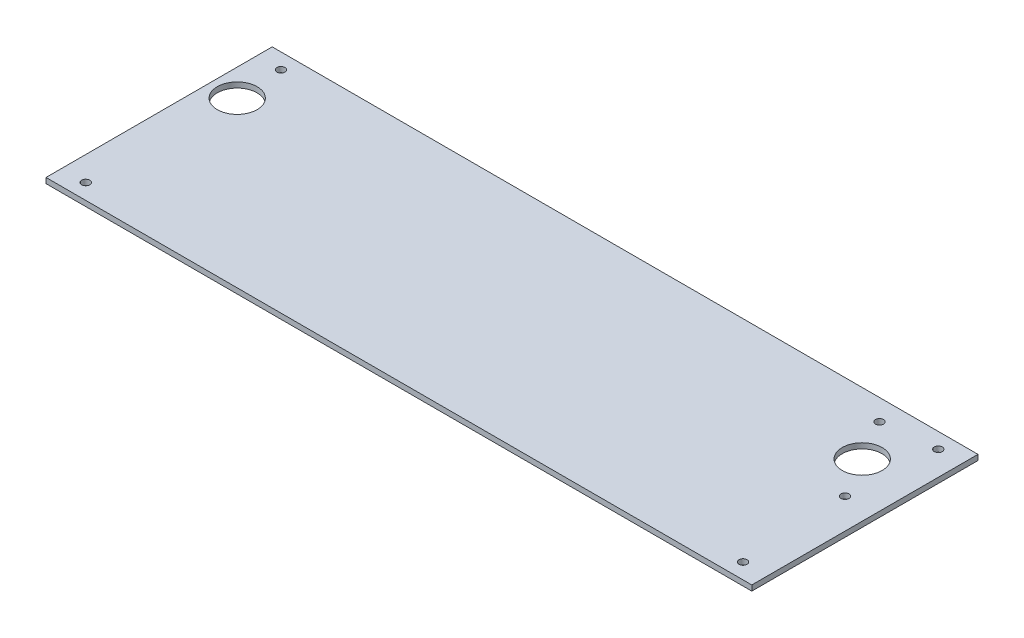
from build123d import *

# Parameters (mm, degrees)
SKETCH_1_W         = 262.1
SKETCH_1_H         = 84
EXTRUDE_1_DEPTH    = 1
SKETCH1_R          = 1.5
CUT_EXTRUDE1_DEPTH = 10
SKETCH4_R          = 7.4
CUT_EXTRUDE3_DEPTH = 138.630310978
SKETCH5_R          = 1.5
CUT_EXTRUDE4_DEPTH = 10


with BuildPart() as part:
    # 草图1 → 凸台-拉伸1 (new, symmetric)
    with BuildSketch(Plane(origin=(0, 0, 0), x_dir=(1, 0, 0), z_dir=(0, 1, 0))):
        Rectangle(SKETCH_1_W, SKETCH_1_H)
    extrude(amount=EXTRUDE_1_DEPTH, both=True)

    # Sketch1 → Cut-Extrude1 (cut)
    with BuildSketch(Plane(origin=(0, 1, 0), x_dir=(1, 0, 0), z_dir=(0, 1, 0))):
        with Locations(Location((-122.05, 36.25, 0), (0, 0, 270))):
            Circle(SKETCH1_R)
        with Locations(Location((-122.05, -36.25, 0), (0, 0, 270))):
            Circle(SKETCH1_R)
        with Locations(Location((122.05, -36.25, 0), (0, 0, 270))):
            Circle(SKETCH1_R)
        with Locations(Location((122.05, 36.25, 0), (0, 0, 270))):
            Circle(SKETCH1_R)
    extrude(amount=-CUT_EXTRUDE1_DEPTH, mode=Mode.SUBTRACT)

    # Sketch4 → Cut-Extrude3 (cut, through all)
    with BuildSketch(Plane(origin=(0, 1, 0), x_dir=(1, 0, 0), z_dir=(0, 1, 0))):
        with Locations(Location((-121.050000944, 19, 0), (0, 0, 270))):
            Circle(SKETCH4_R)
        with Locations(Location((111.049999056, 19, 0), (0, 0, 270))):
            Circle(SKETCH4_R)
    extrude(amount=-CUT_EXTRUDE3_DEPTH, mode=Mode.SUBTRACT)

    # Sketch5 → Cut-Extrude4 (cut)
    with BuildSketch(Plane(origin=(0, 1, 0), x_dir=(1, 0, 0), z_dir=(0, 1, 0))):
        with Locations(Location((119.799998238, 3.844554962, 0), (0, 0, 270))):
            Circle(SKETCH5_R)
        with Locations(Location((102.299999873, 34.155445038, 0), (0, 0, 270))):
            Circle(SKETCH5_R)
    extrude(amount=-CUT_EXTRUDE4_DEPTH, mode=Mode.SUBTRACT)


solid = part.part
